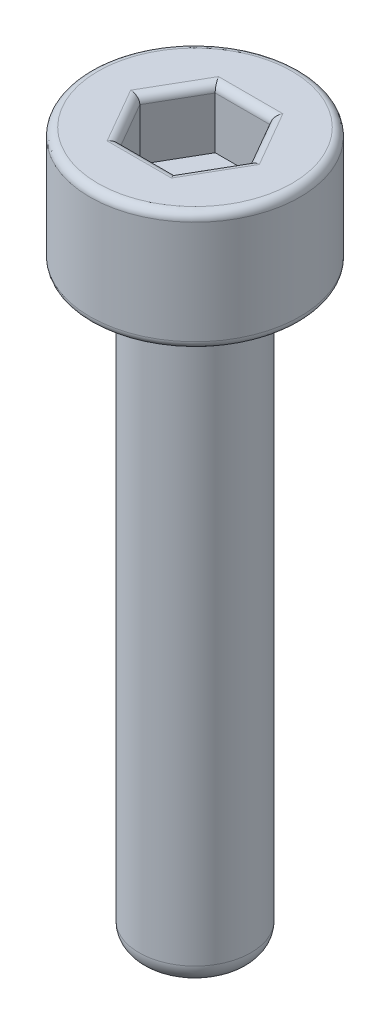
from build123d import *

# Parameters (mm, degrees)
SKETCH1_R           = 2.64
BOSS_EXTRUDE1_DEPTH = 3
SKETCH2_R           = 1.405
BOSS_EXTRUDE2_DEPTH = 14.76
FILLET1_R           = 0.2
CUT_EXTRUDE1_DEPTH  = 1.5
FILLET2_R           = 0.2
FILLET3_R           = 0.5


with BuildPart() as part:
    # Sketch1 → Boss-Extrude1 (new body)
    with BuildSketch(Plane(origin=(0, 0, 0), x_dir=(1, 0, 0), z_dir=(0, 1, 0))):
        with Locations(Location((0, 0, 0), (0, 0, 270))):
            Circle(SKETCH1_R)
    extrude(amount=BOSS_EXTRUDE1_DEPTH)

    # Sketch2 → Boss-Extrude2 (add)
    with BuildSketch(Plane.XZ):
        with Locations(Location((0, 0, 0), (0, 0, 270))):
            Circle(SKETCH2_R)
    extrude(amount=BOSS_EXTRUDE2_DEPTH)

    # Fillet1
    fillet1_edges = [part.edges().sort_by_distance(p)[0] for p in [
        (0, 0, -2.64),
        (0, 3, -2.64),
    ]]
    fillet(fillet1_edges, radius=FILLET1_R)

    # Sketch3 → Cut-Extrude1 (cut)
    with BuildSketch(Plane(origin=(0, 3, 0), x_dir=(1, 0, 0), z_dir=(0, 1, 0))):
        Polygon((1.385640646, 0), (0.692820323, 1.2), (-0.692820323, 1.2), (-1.385640646, 0), (-0.692820323, -1.2), (0.692820323, -1.2), align=None)
    extrude(amount=-CUT_EXTRUDE1_DEPTH, mode=Mode.SUBTRACT)

    # Fillet2
    fillet2_edges = [part.edges().sort_by_distance(p)[0] for p in [
        (1.039230485, 3, 0.6),
        (1.039230485, 3, -0.6),
        (0, 3, -1.2),
        (-1.039230485, 3, -0.6),
        (-1.039230485, 3, 0.6),
        (0, 3, 1.2),
    ]]
    fillet(fillet2_edges, radius=FILLET2_R)

    # Fillet3
    fillet3_edges = [part.edges().sort_by_distance(p)[0] for p in [
        (0, -14.76, 1.405),
    ]]
    fillet(fillet3_edges, radius=FILLET3_R)


solid = part.part
